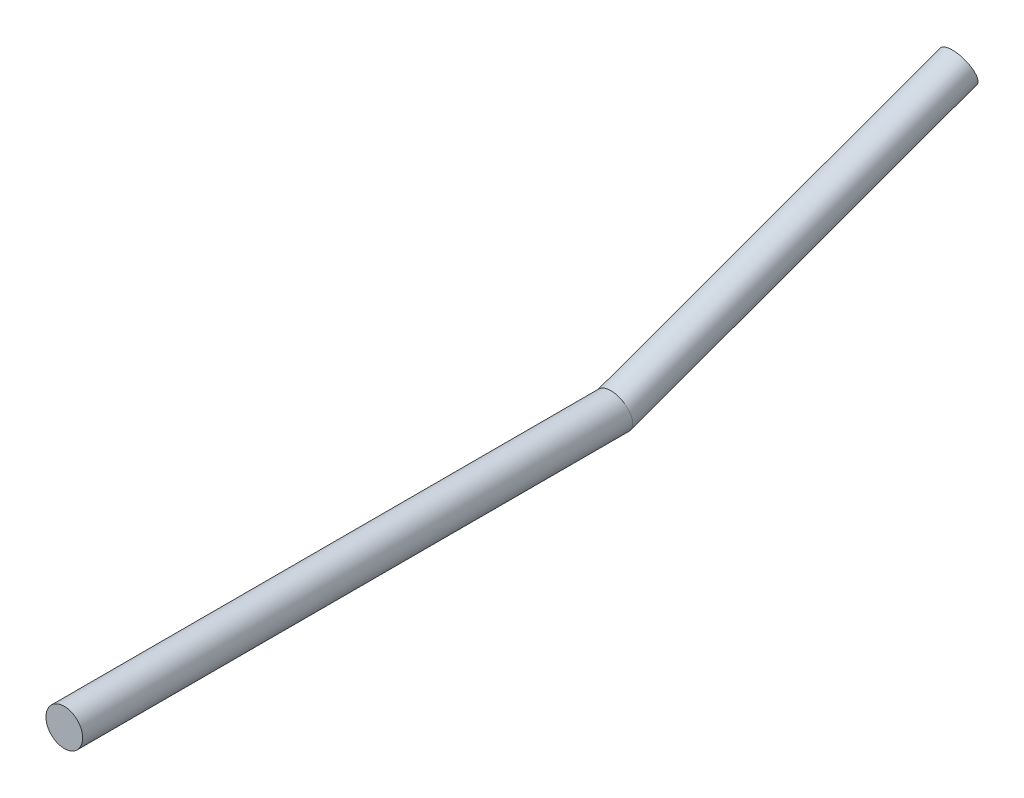
from build123d import *

# Parameters (mm, degrees)
SKETCH2_R = 1.25


with BuildPart() as part:
    # Sweep1: sweep along a path in Sketch1
    with BuildLine(Plane(origin=(0, 0, 0), x_dir=(0, 0, -1), z_dir=(1, 0, 0))) as sweep1_path:
        Line((-37.49, 0), (0, 0))
        Line((0, 0), (23.49231552, 8.550503583))
    # Sketch2 → Sweep1 (sweep)
    with BuildSketch(Plane.XY):
        Circle(SKETCH2_R)
    sweep(path=sweep1_path.line, transition=Transition.RIGHT)


solid = part.part
